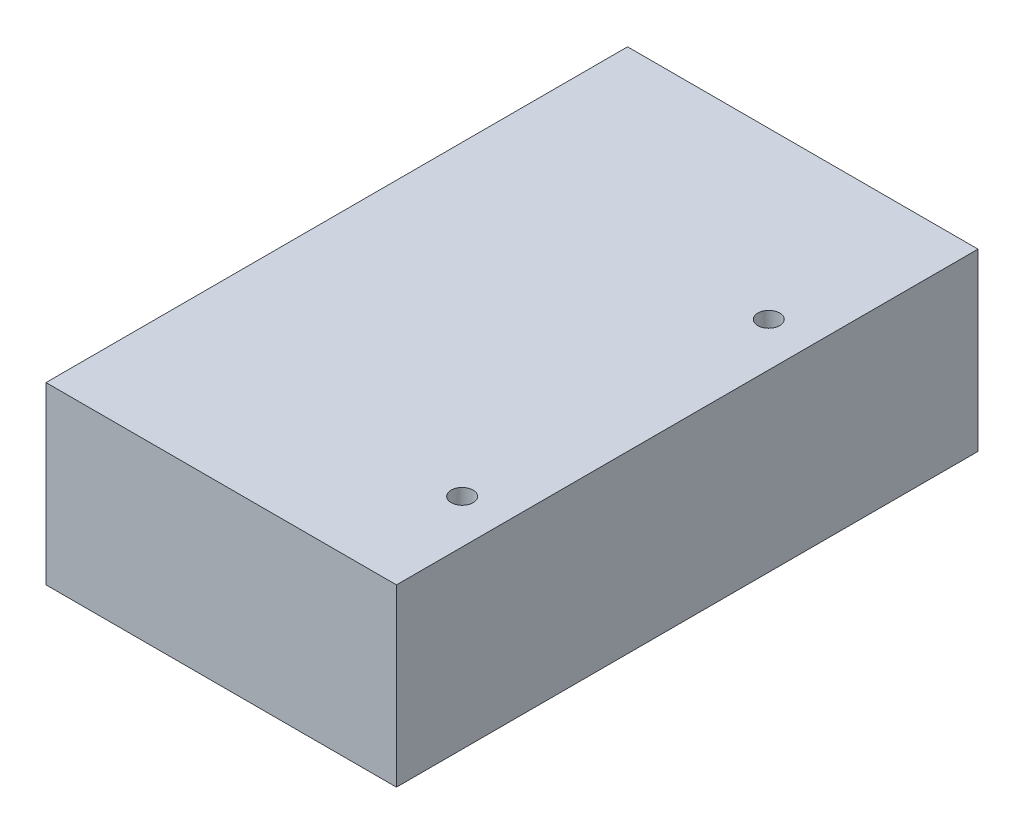
from build123d import *

# Parameters (mm, degrees)
SKETCH1_W           = 50.8
SKETCH1_H           = 76.2
BOSS_EXTRUDE1_DEPTH = 25.4
SKETCH2_R           = 1.5875
CUT_EXTRUDE1_DEPTH  = 96.038097624
SKETCH3_W           = 50.8
SKETCH3_H           = 25.4
BOSS_EXTRUDE2_DEPTH = 8.1026


with BuildPart() as part:
    # Sketch1 → Boss-Extrude1 (new body)
    with BuildSketch(Plane(origin=(0, 0, 0), x_dir=(1, 0, 0), z_dir=(0, 1, 0))):
        with Locations((25.4, 38.1)):
            Rectangle(SKETCH1_W, SKETCH1_H)
    extrude(amount=BOSS_EXTRUDE1_DEPTH)

    # Sketch2 → Cut-Extrude1 (cut, through all)
    with BuildSketch(Plane(origin=(0, 25.4, 0), x_dir=(1, 0, 0), z_dir=(0, 1, 0))):
        with Locations(Location((44.45, 60.325, 0), (0, 0, 270))):
            Circle(SKETCH2_R)
        with Locations(Location((44.45, 15.875, 0), (0, 0, 270))):
            Circle(SKETCH2_R)
    extrude(amount=-CUT_EXTRUDE1_DEPTH, mode=Mode.SUBTRACT)

    # Sketch3 → Boss-Extrude2 (add)
    with BuildSketch(Plane.XY.offset(-76.2)):
        with Locations((25.4, 12.7)):
            Rectangle(SKETCH3_W, SKETCH3_H)
    extrude(amount=-BOSS_EXTRUDE2_DEPTH)


solid = part.part
